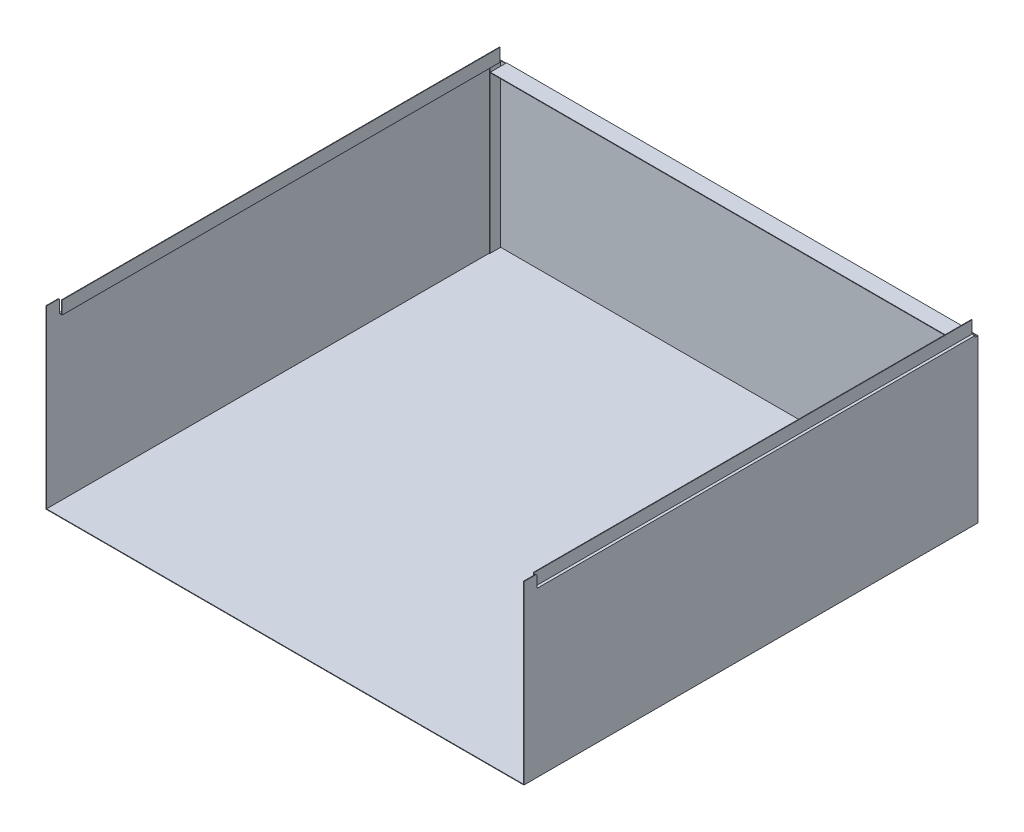
from build123d import *

# Parameters (mm, degrees)
SKETCH1_W           = 442
SKETCH1_H           = 420
BOSS_EXTRUDE1_DEPTH = 0.5
SKETCH2_W           = 0.5
SKETCH2_H           = 420
BOSS_EXTRUDE2_DEPTH = 151
BOSS_EXTRUDE5_DEPTH = 408
BOSS_EXTRUDE3_DEPTH = 149.5
SKETCH41_W          = 3
SKETCH41_H          = 13
CUT_EXTRUDE1_DEPTH  = 3
SKETCH42_W          = 430
SKETCH42_H          = 0.5
BOSS_EXTRUDE6_DEPTH = 147.4
SKETCH43_W          = 429.998697479
SKETCH43_H          = 0.5
BOSS_EXTRUDE7_DEPTH = 15
SKETCH44_W          = 0.5
SKETCH44_H          = 12
BOSS_EXTRUDE8_DEPTH = 11.5
FILLET1_R           = 1
FILLET2_R           = 0.8


with BuildPart() as part:
    # Sketch1 → Boss-Extrude1 (new body)
    with BuildSketch(Plane(origin=(0, 0, 0), x_dir=(1, 0, 0), z_dir=(0, 1, 0))):
        Rectangle(SKETCH1_W, SKETCH1_H)
    extrude(amount=BOSS_EXTRUDE1_DEPTH)

    # Sketch2 → Boss-Extrude2 (add)
    with BuildSketch(Plane(origin=(0, 0.5, 0), x_dir=(1, 0, 0), z_dir=(0, 1, 0))):
        with Locations((-220.75, 0)):
            Rectangle(SKETCH2_W, SKETCH2_H)
        with Locations((220.75, 0)):
            Rectangle(SKETCH2_W, SKETCH2_H)
    extrude(amount=BOSS_EXTRUDE2_DEPTH)

    # Sketch39 → Boss-Extrude5 (add)
    with BuildSketch(Plane(origin=(0, 0, -210), x_dir=(-1, 0, 0), z_dir=(0, 0, -1))):
        Polygon((220.5, 151), (218, 151), (218, 163), (218.5, 163), (218.5, 151.5), (220.5, 151.5), align=None)
        Polygon((-220.5, 151.5), (-220.5, 151), (-218, 151), (-218, 163), (-218.5, 163), (-218.5, 151.5), align=None)
    extrude(amount=-BOSS_EXTRUDE5_DEPTH)

    # Sketch41 → Cut-Extrude1 (cut)
    with BuildSketch(Plane(origin=(0, 0, -210), x_dir=(-1, 0, 0), z_dir=(0, 0, -1))):
        with Locations((219.5, 156.5)):
            Rectangle(SKETCH41_W, SKETCH41_H)
        with Locations((-219.5, 156.5)):
            Rectangle(SKETCH41_W, SKETCH41_H)
    extrude(amount=-CUT_EXTRUDE1_DEPTH, mode=Mode.SUBTRACT)


with BuildPart() as body_2:
    # Sketch7 → Boss-Extrude3 (new body)
    with BuildSketch(Plane(origin=(0, 0.5, 0), x_dir=(1, 0, 0), z_dir=(0, 1, 0))):
        Polygon((-220.5, 210), (220.5, 210), (220.5, 199.5), (220, 199.5), (220, 209.5), (-220, 209.5), (-220, 199.5), (-220.5, 199.5), align=None)
    extrude(amount=BOSS_EXTRUDE3_DEPTH)


    add(part.part)  # Boss-Extrude6 merges part
    # Sketch42 → Boss-Extrude6 (add)
    with BuildSketch(Plane(origin=(0, 150, 0), x_dir=(1, 0, 0), z_dir=(0, 1, 0))):
        with Locations((0, 209.75)):
            Rectangle(SKETCH42_W, SKETCH42_H)
    extrude(amount=-BOSS_EXTRUDE6_DEPTH)

    # Sketch43 → Boss-Extrude7 (add)
    with BuildSketch(Plane.XY.offset(-210)):
        with Locations((-0.00065126, 150.25)):
            Rectangle(SKETCH43_W, SKETCH43_H)
    extrude(amount=BOSS_EXTRUDE7_DEPTH)

    # Sketch44 → Boss-Extrude8 (add)
    with BuildSketch(Plane(origin=(0, 151.5, 0), x_dir=(1, 0, 0), z_dir=(0, 1, 0))):
        with Locations((-220.75, -204)):
            Rectangle(SKETCH44_W, SKETCH44_H)
        with Locations((220.75, -204)):
            Rectangle(SKETCH44_W, SKETCH44_H)
    extrude(amount=BOSS_EXTRUDE8_DEPTH)

    # Fillet1
    fillet1_edges = [body_2.edges().sort_by_distance(p)[0] for p in [
        (-220.75, 163, 198),
        (220.75, 163, 198),
    ]]
    fillet(fillet1_edges, radius=FILLET1_R)

    # Fillet2
    fillet2_edges = [body_2.edges().sort_by_distance(p)[0] for p in [
        (-220.75, 151.5, 198),
        (220.75, 151.5, 198),
    ]]
    fillet(fillet2_edges, radius=FILLET2_R)


solid = body_2.part
